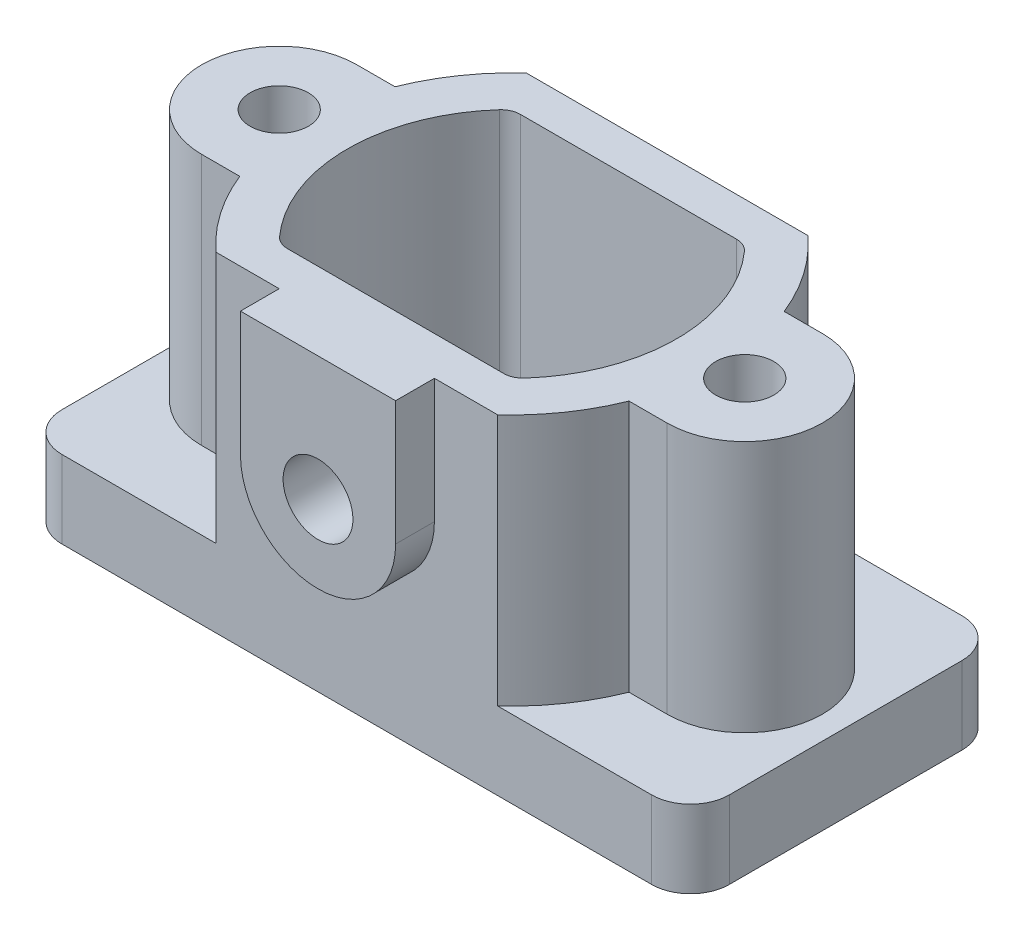
from build123d import *

# Parameters (mm, degrees)
SKETCH_1_W               = 172
SKETCH_1_H               = 80
EXTRUDE_1_DEPTH          = 20
FILLET_1_R               = 10
SKETCH_2_R               = 7.5
EXTRUDE_2_DEPTH          = 65
CUT_EXTRUDE_1_DEPTH      = 65
EXTRUDE_3_DEPTH          = 10
CUT_EXTRUDE_2_DEPTH      = 10
CUT_EXTRUDE_2_DEPTH_BACK = 10
SKETCH_5_R               = 9
FILLET_2_R               = 5


with BuildPart() as part:
    # 草图1 → 凸台-拉伸1 (new body)
    with BuildSketch(Plane(origin=(0, 0, 0), x_dir=(1, 0, 0), z_dir=(0, 1, 0))):
        Rectangle(SKETCH_1_W, SKETCH_1_H)
        with BuildLine():
            Line((-30, -12.5), (-18.708286934, -12.5))
            ThreePointArc((-18.708286934, -12.5), (0, -22.5), (18.708286934, -12.5))
            Line((18.708286934, -12.5), (30, -12.5))
            Line((30, -12.5), (30, 12.5))
            Line((30, 12.5), (18.708286934, 12.5))
            ThreePointArc((18.708286934, 12.5), (0, 22.5), (-18.708286934, 12.5))
            Line((-18.708286934, 12.5), (-30, 12.5))
            Line((-30, 12.5), (-30, -12.5))
        make_face(mode=Mode.SUBTRACT)
    extrude(amount=EXTRUDE_1_DEPTH)

    # 圆角1
    fillet_1_edges = [part.edges().sort_by_distance(p)[0] for p in [
        (86, 10, -40),
        (86, 10, 40),
        (-86, 10, 40),
        (-86, 10, -40),
    ]]
    fillet(fillet_1_edges, radius=FILLET_1_R)

    # 草图2 → 凸台-拉伸2 (add)
    with BuildSketch(Plane(origin=(0, 20, 0), x_dir=(1, 0, 0), z_dir=(0, 1, 0))):
        with BuildLine():
            Line((-36.276714294, 40), (36.276714294, 40))
            ThreePointArc((36.276714294, 40), (44.36006499, 30.792606809), (50.159744816, 20))
            Line((50.159744816, 20), (60, 20))
            ThreePointArc((60, 20), (80, 0), (60, -20))
            Line((60, -20), (50.159744816, -20))
            ThreePointArc((50.159744816, -20), (44.36006499, -30.792606809), (36.276714294, -40))
            Line((36.276714294, -40), (-36.276714294, -40))
            ThreePointArc((-36.276714294, -40), (-44.36006499, -30.792606809), (-50.159744816, -20))
            Line((-50.159744816, -20), (-60, -20))
            ThreePointArc((-60, -20), (-80, 0), (-60, 20))
            Line((-60, 20), (-50.159744816, 20))
            ThreePointArc((-50.159744816, 20), (-44.36006499, 30.792606809), (-36.276714294, 40))
        make_face()
        with Locations((-60, 0)):
            Circle(SKETCH_2_R, mode=Mode.SUBTRACT)
        with Locations((60, 0)):
            Circle(SKETCH_2_R, mode=Mode.SUBTRACT)
    extrude(amount=EXTRUDE_2_DEPTH)

    # 草图3 → 切除-拉伸1 (cut)
    with BuildSketch(Plane(origin=(0, 20, 0), x_dir=(1, 0, 0), z_dir=(0, 1, 0))):
        with BuildLine():
            Line((-30, 30), (30, 30))
            ThreePointArc((30, 30), (42.426406871, 0), (30, -30))
            Line((30, -30), (-30, -30))
            ThreePointArc((-30, -30), (-42.426406871, 0), (-30, 30))
        make_face()
    extrude(amount=CUT_EXTRUDE_1_DEPTH, mode=Mode.SUBTRACT)

    # 草图4 → 凸台-拉伸3 (add)
    with BuildSketch(Plane.XY.offset(40)):
        with BuildLine():
            Line((-20, 53), (-20, 85))
            Line((-20, 85), (20, 85))
            Line((20, 85), (20, 53))
            ThreePointArc((20, 53), (0, 33), (-20, 53))
        make_face()
    extrude(amount=EXTRUDE_3_DEPTH)

    # 草图5 → 切除-拉伸2 (cut, two sides: drawn at the far end of the back side and taken through both)
    with BuildSketch(Plane.XY.offset(40).offset(-CUT_EXTRUDE_2_DEPTH_BACK)):
        with Locations((0, 53)):
            Circle(SKETCH_5_R)
    extrude(amount=CUT_EXTRUDE_2_DEPTH + CUT_EXTRUDE_2_DEPTH_BACK, mode=Mode.SUBTRACT)

    # 圆角2
    fillet_2_edges = [part.edges().sort_by_distance(p)[0] for p in [
        (-30, 52.5, 30),
        (30, 52.5, 30),
        (30, 52.5, -30),
        (-30, 52.5, -30),
    ]]
    fillet(fillet_2_edges, radius=FILLET_2_R)


solid = part.part
